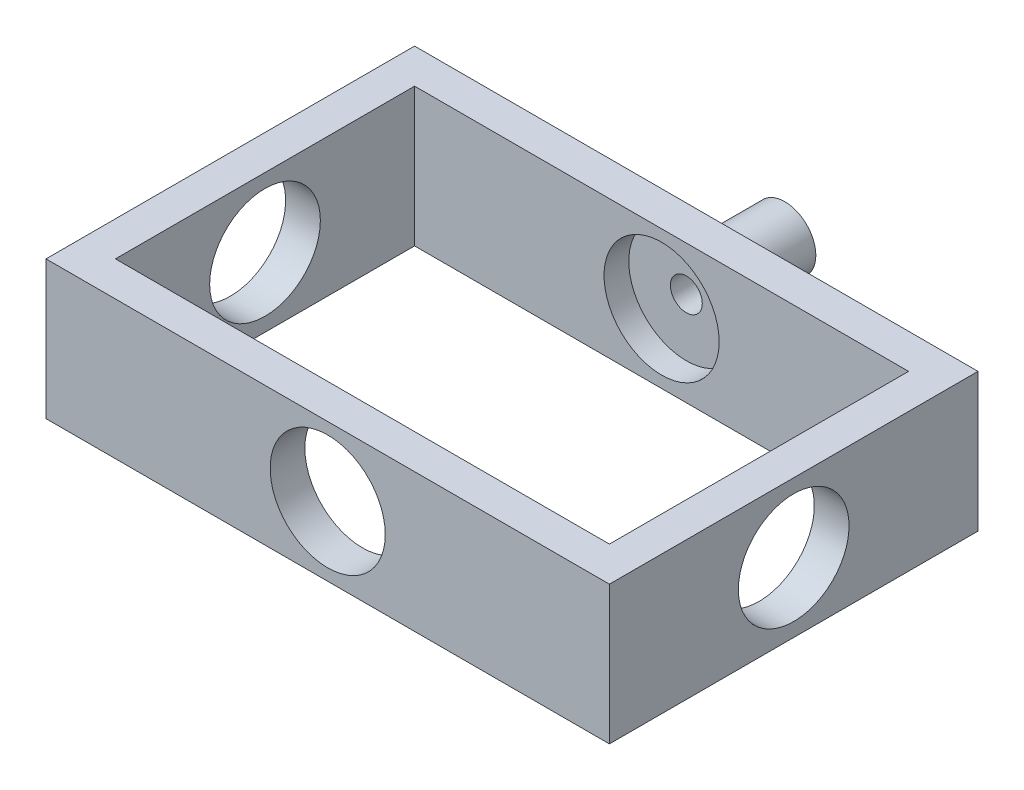
from build123d import *

# Parameters (mm, degrees)
SKETCH1_W           = 32.3215
SKETCH1_H           = 21.1455
SKETCH1_W_2         = 28.33878
SKETCH1_H_2         = 17.16278
BOSS_EXTRUDE1_DEPTH = 7.9375
SKETCH2_R           = 3.175
CUT_EXTRUDE1_DEPTH  = 37.1475
SKETCH3_R           = 3.302
CUT_EXTRUDE2_DEPTH  = 20.574
SKETCH4_R           = 1.778
BOSS_EXTRUDE3_DEPTH = 5.08
SKETCH6_R           = 0.9144
CUT_EXTRUDE3_DEPTH  = 10.922


with BuildPart() as part:
    # Sketch1 → Boss-Extrude1 (new body)
    with BuildSketch(Plane(origin=(0, 0, 0), x_dir=(1, 0, 0), z_dir=(0, 1, 0))):
        Rectangle(SKETCH1_W, SKETCH1_H)
        Rectangle(SKETCH1_W_2, SKETCH1_H_2, mode=Mode.SUBTRACT)
    extrude(amount=BOSS_EXTRUDE1_DEPTH)

    # Sketch2 → Cut-Extrude1 (cut)
    with BuildSketch(Plane.ZY.offset(16.16075)):
        with Locations((0, 3.96875)):
            Circle(SKETCH2_R)
    extrude(amount=-CUT_EXTRUDE1_DEPTH, mode=Mode.SUBTRACT)

    # Sketch3 → Cut-Extrude2 (cut)
    with BuildSketch(Plane.XY.offset(10.57275)):
        with Locations((0, 3.96875)):
            Circle(SKETCH3_R)
    extrude(amount=-CUT_EXTRUDE2_DEPTH, mode=Mode.SUBTRACT)

    # Sketch4 → Boss-Extrude3 (add)
    with BuildSketch(Plane(origin=(0, 0, -10.57275), x_dir=(-1, 0, 0), z_dir=(0, 0, -1))):
        with Locations(Location((0, 3.96875, 0), (0, 0, 180))):
            Circle(SKETCH4_R)
    extrude(amount=BOSS_EXTRUDE3_DEPTH)

    # Sketch6 → Cut-Extrude3 (cut)
    with BuildSketch(Plane(origin=(0, 0, -15.65275), x_dir=(-1, 0, 0), z_dir=(0, 0, -1))):
        with Locations((0, 3.96875)):
            Circle(SKETCH6_R)
    extrude(amount=-CUT_EXTRUDE3_DEPTH, mode=Mode.SUBTRACT)


solid = part.part
